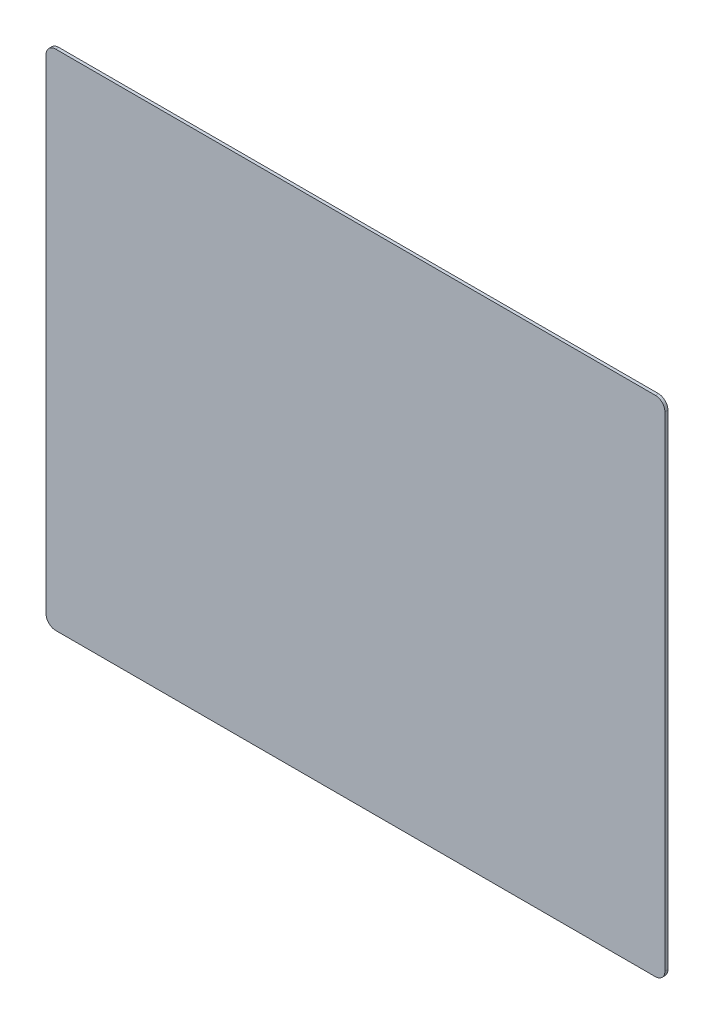
from build123d import *

# Parameters (mm, degrees)
SKETCH1_W           = 647.7
SKETCH1_H           = 526.976
BOSS_EXTRUDE1_DEPTH = 3.175
FILLET1_R           = 10


with BuildPart() as part:
    # Sketch1 → Boss-Extrude1 (new body)
    with BuildSketch(Plane.XY):
        with Locations((-152.648046875, -126.020421875)):
            Rectangle(SKETCH1_W, SKETCH1_H)
    extrude(amount=BOSS_EXTRUDE1_DEPTH)

    # Fillet1
    fillet1_edges = [part.edges().sort_by_distance(p)[0] for p in [
        (-476.498046875, 137.467578125, 1.5875),
        (171.201953125, 137.467578125, 1.5875),
        (171.201953125, -389.508421875, 1.5875),
        (-476.498046875, -389.508421875, 1.5875),
    ]]
    fillet(fillet1_edges, radius=FILLET1_R)


solid = part.part
